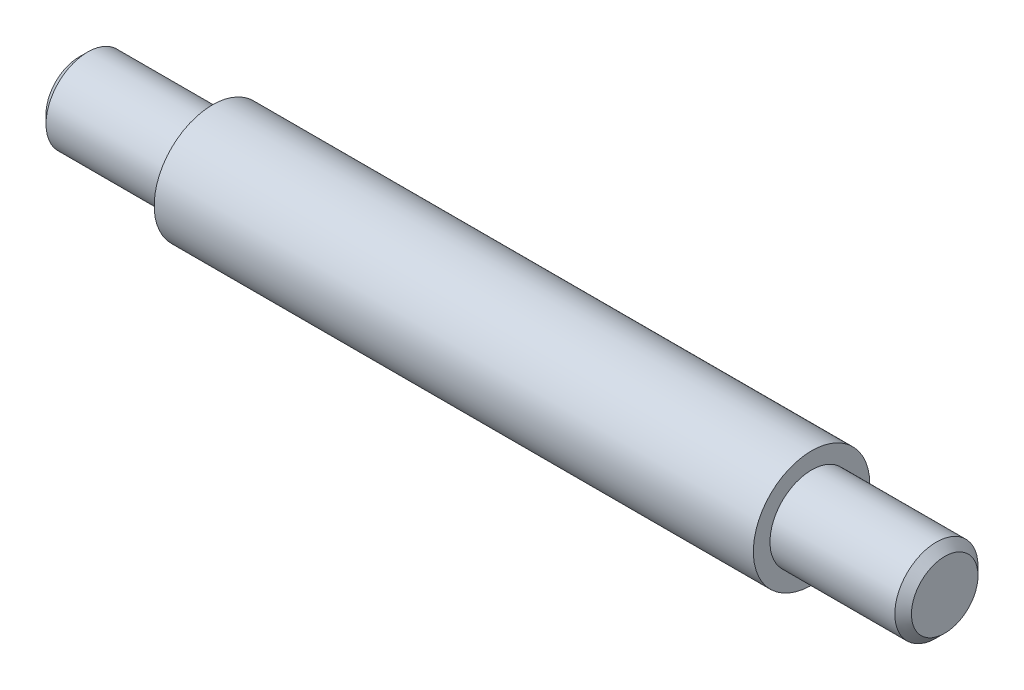
from build123d import *

# Parameters (mm, degrees)
SCHIZZO1_R                   = 3.5
ESTRUSIONE_ESTRUSIONE1_DEPTH = 18
SCHIZZO2_R                   = 2.5
ESTRUSIONE_ESTRUSIONE2_DEPTH = 8
ESTRUSIONE_ESTRUSIONE3_START = 8
SCHIZZO3_R                   = 2.5
ESTRUSIONE_ESTRUSIONE3_DEPTH = 8
SMUSSO1_SIZE                 = 0.5


with BuildPart() as part:
    # Schizzo1 → Estrusione-Estrusione1 (new, symmetric)
    with BuildSketch(Plane(origin=(0, 0, 0), x_dir=(0, 0, -1), z_dir=(1, 0, 0))):
        with Locations((-80, 0)):
            Circle(SCHIZZO1_R)
    extrude(amount=ESTRUSIONE_ESTRUSIONE1_DEPTH, both=True)

    # Schizzo2 → Estrusione-Estrusione2 (add)
    with BuildSketch(Plane(origin=(18, 0, 0), x_dir=(0, 0, -1), z_dir=(1, 0, 0))):
        with Locations((-80, 0)):
            Circle(SCHIZZO2_R)
    extrude(amount=ESTRUSIONE_ESTRUSIONE2_DEPTH)

    # Schizzo3 → Estrusione-Estrusione3 (add)
    with BuildSketch(Plane.ZY.offset(18).offset(ESTRUSIONE_ESTRUSIONE3_START)):
        with Locations(Location((80, 0, 0), (0, 0, 180))):
            Circle(SCHIZZO3_R)
    extrude(amount=-ESTRUSIONE_ESTRUSIONE3_DEPTH)

    # Smusso1
    smusso1_edges = [part.edges().sort_by_distance(p)[0] for p in [
        (-26, 0, 82.5),
        (26, 0, 82.5),
    ]]
    chamfer(smusso1_edges, length=SMUSSO1_SIZE)


solid = part.part
